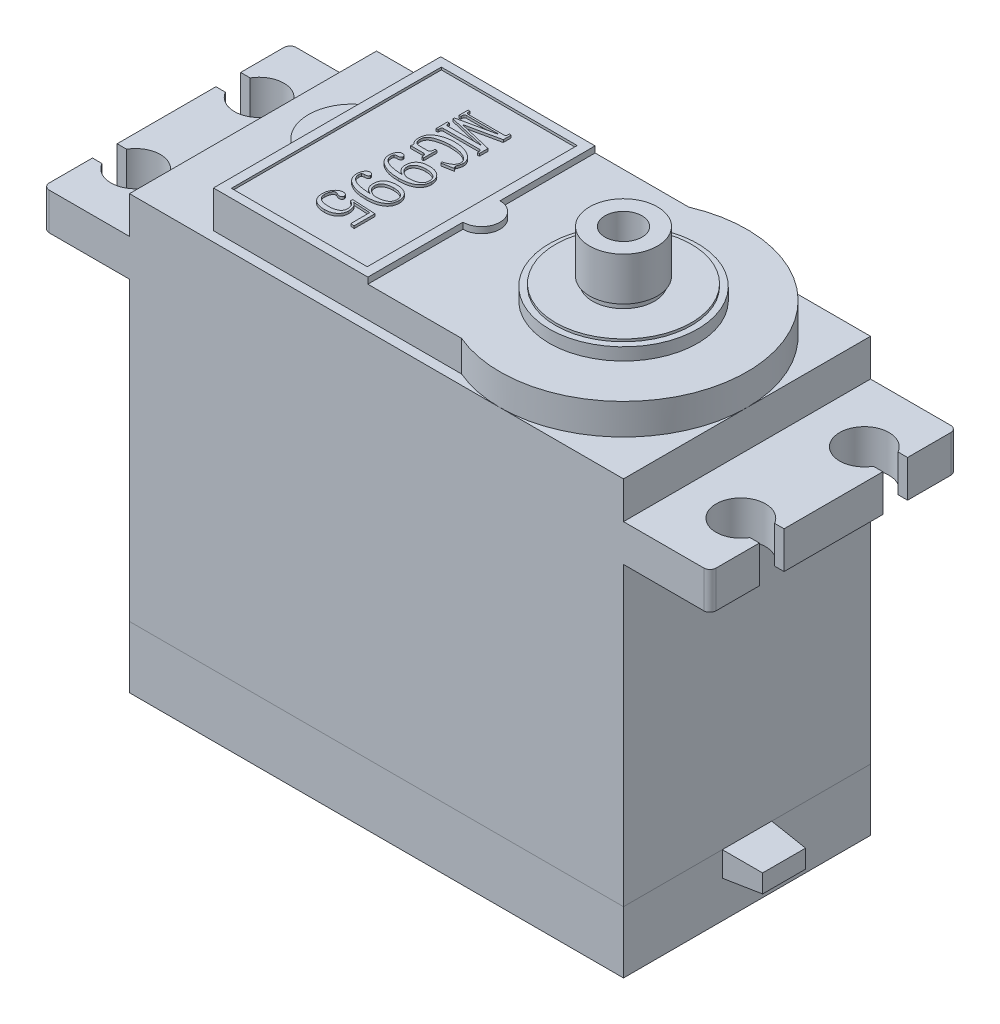
from build123d import *

# Parameters (mm, degrees)
SKETCH_1_W          = 40
SKETCH_1_H          = 37
EXTRUDE_1_DEPTH     = 20
CHAMFER_1_SIZE      = 2
SKETCH_2_W          = 33.2
SKETCH_2_H          = 18.4
EXTRUDE_2_DEPTH     = 3
SKETCH_3_R          = 10
EXTRUDE_3_DEPTH     = 3
CUT_EXTRUDE_1_DEPTH = 3
CUT_EXTRUDE_2_DEPTH = 0.5
SKETCH_6_R          = 1.5
EXTRUDE_4_DEPTH     = 0.5
SKETCH_7_R          = 6
EXTRUDE_5_DEPTH     = 1
SKETCH_8_R          = 5.5
EXTRUDE_6_DEPTH     = 0.2
SKETCH_9_R          = 2.75
EXTRUDE_7_DEPTH     = 4
SKETCH_10_R         = 1.5
CUT_EXTRUDE_3_DEPTH = 3
SKETCH_12_R         = 2.75
SKETCH_12_R_2       = 2.5
CUT_EXTRUDE_4_DEPTH = 0.5
EXTRUDE_START       = -6
SKETCH_13_W         = 7
SKETCH_13_H         = 20
EXTRUDE_8_DEPTH     = 3
SKETCH_14_R         = 2
CUT_EXTRUDE_5_DEPTH = 48.801673611
SKETCH_15_W         = 3.144960108
SKETCH_15_H         = 2
CUT_EXTRUDE_6_DEPTH = 48.801673611
FILLET_1_R          = 0.5
EXTRUDE_START_2     = -0.2
EXTRUDE_9_DEPTH     = 2.8
SKETCH_18_W         = 4
SKETCH_18_H         = 2
EXTRUDE_10_DEPTH    = 3
EXTRUDE_10_TAPER    = 5
SKETCH_19_W         = 11
SKETCH_19_H         = 17
CUT_EXTRUDE_7_DEPTH = 0.2
EXTRUDE_11_DEPTH    = 0.2


with BuildPart() as part:
    # 草图1 → 凸台-拉伸1 (new body)
    with BuildSketch(Plane.XY):
        Rectangle(SKETCH_1_W, SKETCH_1_H)
    extrude(amount=EXTRUDE_1_DEPTH)

    # 倒角1
    chamfer_1_edges = [part.edges().sort_by_distance(p)[0] for p in [
        (0, -18.5, 20),
        (0, -18.5, 0),
        (20, -18.5, 10),
        (-20, -18.5, 10),
    ]]
    chamfer(chamfer_1_edges, length=CHAMFER_1_SIZE)

    # 草图2 → 凸台-拉伸2 (add)
    with BuildSketch(Plane(origin=(0, 18.5, 0), x_dir=(1, 0, 0), z_dir=(0, 1, 0))):
        with Locations((2.6, -10)):
            Rectangle(SKETCH_2_W, SKETCH_2_H)
    extrude(amount=EXTRUDE_2_DEPTH)

    # 草图3 → 凸台-拉伸3 (add)
    with BuildSketch(Plane(origin=(0, 21.5, 0), x_dir=(1, 0, 0), z_dir=(0, 1, 0))):
        with Locations((10, -10)):
            Circle(SKETCH_3_R)
    extrude(amount=-EXTRUDE_3_DEPTH)

    # 草图4 → 切除-拉伸1 (cut)
    with BuildSketch(Plane(origin=(0, 21.5, 0), x_dir=(1, 0, 0), z_dir=(0, 1, 0))):
        with BuildLine():
            Line((13.919183588, -0.8), (19.2, -0.8))
            Line((19.2, -0.8), (19.2, -6.080816412))
            ThreePointArc((19.2, -6.080816412), (17.071067812, -2.928932188), (13.919183588, -0.8))
        make_face()
        with BuildLine():
            Line((13.919183588, -19.2), (19.2, -19.2))
            Line((19.2, -19.2), (19.2, -13.919183588))
            ThreePointArc((19.2, -13.919183588), (17.071067812, -17.071067812), (13.919183588, -19.2))
        make_face()
    extrude(amount=-CUT_EXTRUDE_1_DEPTH, mode=Mode.SUBTRACT)

    # 草图5 → 切除-拉伸2 (cut)
    with BuildSketch(Plane(origin=(0, 21.5, 0), x_dir=(1, 0, 0), z_dir=(0, 1, 0))):
        Polygon((-1.5, -0.8), (-1.5, -20), (20, -20), (20, 0), (-1.5, 0), align=None)
    extrude(amount=-CUT_EXTRUDE_2_DEPTH, mode=Mode.SUBTRACT)

    # 草图6 → 凸台-拉伸4 (add)
    with BuildSketch(Plane(origin=(0, 21, 0), x_dir=(1, 0, 0), z_dir=(0, 1, 0))):
        with Locations((-1.5, -10)):
            Circle(SKETCH_6_R)
    extrude(amount=EXTRUDE_4_DEPTH)

    # 草图7 → 凸台-拉伸5 (add)
    with BuildSketch(Plane(origin=(0, 21, 0), x_dir=(1, 0, 0), z_dir=(0, 1, 0))):
        with Locations(Location((10, -10, 0), (0, 0, 270))):
            Circle(SKETCH_7_R)
    extrude(amount=EXTRUDE_5_DEPTH)

    # 草图8 → 凸台-拉伸6 (add)
    with BuildSketch(Plane(origin=(0, 22, 0), x_dir=(1, 0, 0), z_dir=(0, 1, 0))):
        with Locations(Location((10, -10, 0), (0, 0, 270))):
            Circle(SKETCH_8_R)
    extrude(amount=EXTRUDE_6_DEPTH)

    # 草图9 → 凸台-拉伸7 (add)
    with BuildSketch(Plane(origin=(0, 22.2, 0), x_dir=(1, 0, 0), z_dir=(0, 1, 0))):
        with Locations(Location((10, -10, 0), (0, 0, 270))):
            Circle(SKETCH_9_R)
    extrude(amount=EXTRUDE_7_DEPTH)

    # 草图10 → 切除-拉伸3 (cut)
    with BuildSketch(Plane(origin=(0, 26.2, 0), x_dir=(1, 0, 0), z_dir=(0, 1, 0))):
        with Locations(Location((10, -10, 0), (0, 0, 270))):
            Circle(SKETCH_10_R)
    extrude(amount=-CUT_EXTRUDE_3_DEPTH, mode=Mode.SUBTRACT)

    # 草图12 → 切除-拉伸4 (cut)
    with BuildSketch(Plane(origin=(0, 22.2, 0), x_dir=(1, 0, 0), z_dir=(0, 1, 0))):
        with Locations(Location((10, -10, 0), (0, 0, 270))):
            Circle(SKETCH_12_R)
        with Locations(Location((10, -10, 0), (0, 0, 270))):
            Circle(SKETCH_12_R_2, mode=Mode.SUBTRACT)
    extrude(amount=CUT_EXTRUDE_4_DEPTH, mode=Mode.SUBTRACT)

    # 草图13 → 凸台-拉伸8 (add)
    with BuildSketch(Plane(origin=(0, 18.5, 0), x_dir=(1, 0, 0), z_dir=(0, 1, 0)).offset(EXTRUDE_START)):
        with Locations((23.5, -10)):
            Rectangle(SKETCH_13_W, SKETCH_13_H)
        with Locations((-23.5, -10)):
            Rectangle(SKETCH_13_W, SKETCH_13_H)
    extrude(amount=EXTRUDE_8_DEPTH)

    # 草图14 → 切除-拉伸5 (cut, through all)
    with BuildSketch(Plane(origin=(0, 15.5, 0), x_dir=(1, 0, 0), z_dir=(0, 1, 0))):
        with Locations(Location((24.5, -5, 0), (0, 0, 270))):
            Circle(SKETCH_14_R)
        with Locations(Location((24.5, -15, 0), (0, 0, 270))):
            Circle(SKETCH_14_R)
        with Locations(Location((-24.5, -15, 0), (0, 0, 270))):
            Circle(SKETCH_14_R)
        with Locations(Location((-24.5, -5, 0), (0, 0, 270))):
            Circle(SKETCH_14_R)
    extrude(amount=-CUT_EXTRUDE_5_DEPTH, mode=Mode.SUBTRACT)

    # 草图15 → 切除-拉伸6 (cut, through all)
    with BuildSketch(Plane(origin=(0, 15.5, 0), x_dir=(1, 0, 0), z_dir=(0, 1, 0))):
        with Locations((26.464456373, -5)):
            Rectangle(SKETCH_15_W, SKETCH_15_H)
        with Locations((26.464456373, -15)):
            Rectangle(SKETCH_15_W, SKETCH_15_H)
        with Locations((-26.464456373, -15)):
            Rectangle(SKETCH_15_W, SKETCH_15_H)
        with Locations((-26.464456373, -5)):
            Rectangle(SKETCH_15_W, SKETCH_15_H)
    extrude(amount=-CUT_EXTRUDE_6_DEPTH, mode=Mode.SUBTRACT)

    # 圆角1
    fillet_1_edges = [part.edges().sort_by_distance(p)[0] for p in [
        (-27, 14, 20),
        (-27, 14, 0),
        (27, 14, 0),
        (27, 14, 20),
    ]]
    fillet(fillet_1_edges, radius=FILLET_1_R)

    # 草图16 → 凸台-拉伸9 (add)
    with BuildSketch(Plane(origin=(0, 21.5, 0), x_dir=(1, 0, 0), z_dir=(0, 1, 0)).offset(EXTRUDE_START_2)):
        with BuildLine():
            Line((-14, -7.127718677), (-14, -12.872281323))
            ThreePointArc((-14, -12.872281323), (-15.5, -10), (-14, -7.127718677))
        make_face()
    extrude(amount=-EXTRUDE_9_DEPTH)

    # 草图18 → 凸台-拉伸10 (add)
    with BuildSketch(Plane(origin=(20, 0, 0), x_dir=(0, 0, -1), z_dir=(1, 0, 0))):
        with Locations((-10, -12.5)):
            Rectangle(SKETCH_18_W, SKETCH_18_H)
    extrude(amount=EXTRUDE_10_DEPTH, taper=EXTRUDE_10_TAPER)

    # 草图19 → 切除-拉伸7 (cut)
    with BuildSketch(Plane(origin=(0, 21.5, 0), x_dir=(1, 0, 0), z_dir=(0, 1, 0))):
        with Locations((-7.75, -10)):
            Rectangle(SKETCH_19_W, SKETCH_19_H)
    extrude(amount=-CUT_EXTRUDE_7_DEPTH, mode=Mode.SUBTRACT)

    # 草图20 → 凸台-拉伸11 (add)
    # profile 1 of 5: a face of its own
    with BuildSketch(Plane(origin=(0, 21.3, 0), x_dir=(1, 0, 0), z_dir=(0, 1, 0))):
        with BuildLine():
            add(Edge.make_bspline(
                [(-8.84516059, -5.722222222), (-8.85787049, -5.723014085), (-8.881942841, -5.724513861), (-8.916370905, -5.734174173), (-8.944677077, -5.75314092), (-8.968232942, -5.778033073), (-8.985097452, -5.808956215), (-8.998422683, -5.843598085), (-9.005900694, -5.882678632), (-9.006587817, -5.910053955), (-9.006944444, -5.924262153)],
                knots=[0, 0, 0, 0, 1.042968028, 1.975365066, 2.8907423, 3.801164498, 4.758861516, 5.757301539, 6.836006302, 8, 8, 8, 8], degree=3))
            Line((-9.006944444, -5.924262153), (-9.006944444, -6.013888889))
            Line((-9.006944444, -6.013888889), (-9.152777778, -6.013888889))
            Line((-9.152777778, -6.013888889), (-9.152777778, -5.090277778))
            Line((-9.152777778, -5.090277778), (-9.006944444, -5.090277778))
            Line((-9.006944444, -5.090277778), (-9.006944444, -5.194335937))
            add(Edge.make_bspline(
                [(-9.006944444, -5.194335937), (-9.006637075, -5.210317157), (-9.006066861, -5.239964627), (-8.998757766, -5.280885945), (-8.985979339, -5.314282965), (-8.968179161, -5.340911334), (-8.944009951, -5.35982386), (-8.915198712, -5.372368656), (-8.881894153, -5.381341437), (-8.857888341, -5.381735509), (-8.84516059, -5.381944444)],
                knots=[0, 0, 0, 0, 1.338096298, 2.482361895, 3.463338907, 4.316722401, 5.1317985, 5.995666214, 6.93731314, 8, 8, 8, 8], degree=3))
            Line((-8.84516059, -5.381944444), (-6.201931424, -5.381944444))
            Line((-6.201931424, -5.381944444), (-6.201931424, -5.341688368))
            Line((-6.201931424, -5.341688368), (-9.152777778, -4.658854167))
            Line((-9.152777778, -4.658854167), (-9.152777778, -4.538085937))
            Line((-9.152777778, -4.538085937), (-6.262695312, -3.915256076))
            Line((-6.262695312, -3.915256076), (-6.262695312, -3.875))
            Line((-6.262695312, -3.875), (-8.84516059, -3.875))
            add(Edge.make_bspline(
                [(-8.84516059, -3.875), (-8.857924896, -3.875624789), (-8.882257538, -3.876815828), (-8.916252282, -3.888809894), (-8.945280606, -3.908186367), (-8.968193294, -3.93563155), (-8.985301781, -3.968798557), (-8.99837163, -4.006346187), (-9.005946719, -4.048634944), (-9.006602209, -4.078274809), (-9.006944444, -4.09375)],
                knots=[0, 0, 0, 0, 0.994673065, 1.896148803, 2.780067344, 3.692559487, 4.657844563, 5.684502589, 6.79106185, 8, 8, 8, 8], degree=3))
            Line((-9.006944444, -4.09375), (-9.006944444, -4.166666667))
            Line((-9.006944444, -4.166666667), (-9.152777778, -4.166666667))
            Line((-9.152777778, -4.166666667), (-9.152777778, -3.4375))
            Line((-9.152777778, -3.4375), (-9.006944444, -3.4375))
            Line((-9.006944444, -3.4375), (-9.006944444, -3.510416667))
            add(Edge.make_bspline(
                [(-9.006944444, -3.510416667), (-9.006640117, -3.529178465), (-9.00607773, -3.563849692), (-8.998835008, -3.611526584), (-8.986235461, -3.650239606), (-8.968520651, -3.680905642), (-8.944456797, -3.703111), (-8.915636225, -3.718359189), (-8.881936494, -3.727740957), (-8.857885741, -3.728673345), (-8.84516059, -3.729166667)],
                knots=[0, 0, 0, 0, 1.438107258, 2.657578084, 3.683058142, 4.54557284, 5.342418122, 6.159126252, 7.026001517, 8, 8, 8, 8], degree=3))
            Line((-8.84516059, -3.729166667), (-5.960394965, -3.729166667))
            add(Edge.make_bspline(
                [(-5.960394965, -3.729166667), (-5.947690967, -3.728574266), (-5.923500083, -3.72744622), (-5.889808787, -3.719343763), (-5.861088512, -3.705265799), (-5.837320574, -3.684950059), (-5.819416572, -3.656673206), (-5.806647474, -3.620723507), (-5.799548207, -3.576519616), (-5.798938231, -3.544368731), (-5.798611111, -3.527126736)],
                knots=[0, 0, 0, 0, 1.02027045, 1.942793308, 2.76147956, 3.568971315, 4.420844179, 5.418354805, 6.615505802, 8, 8, 8, 8], degree=3))
            Line((-5.798611111, -3.527126736), (-5.798611111, -3.4375))
            Line((-5.798611111, -3.4375), (-5.652777778, -3.4375))
            Line((-5.652777778, -3.4375), (-5.652777778, -4.082356771))
            Line((-5.652777778, -4.082356771), (-8.29828559, -4.652777778))
            Line((-8.29828559, -4.652777778), (-8.29828559, -4.694552951))
            Line((-8.29828559, -4.694552951), (-5.652777778, -5.317382812))
            Line((-5.652777778, -5.317382812), (-5.652777778, -6.013888889))
            Line((-5.652777778, -6.013888889), (-5.798611111, -6.013888889))
            Line((-5.798611111, -6.013888889), (-5.798611111, -5.924262153))
            add(Edge.make_bspline(
                [(-5.798611111, -5.924262153), (-5.798967916, -5.910054248), (-5.799655382, -5.882679489), (-5.807131026, -5.843595044), (-5.820464362, -5.808966522), (-5.837300712, -5.777997006), (-5.860808651, -5.753422705), (-5.888726298, -5.733779174), (-5.923425524, -5.724669527), (-5.947703999, -5.723062339), (-5.960394965, -5.722222222)],
                knots=[0, 0, 0, 0, 1.163623614, 2.241985409, 3.240107984, 4.197500508, 5.107633243, 6.005382642, 6.957363577, 8, 8, 8, 8], degree=3))
            Line((-5.960394965, -5.722222222), (-8.84516059, -5.722222222))
        make_face()
    # profile 2 of 5: a face of its own
    with BuildSketch(Plane(origin=(0, 21.3, 0), x_dir=(1, 0, 0), z_dir=(0, 1, 0))):
        with BuildLine():
            add(Edge.make_bspline(
                [(-5.75, -7.393988715), (-5.751398335, -7.369304792), (-5.754224314, -7.319419556), (-5.774920857, -7.245904698), (-5.808291765, -7.174330684), (-5.854683907, -7.104531497), (-5.914776557, -7.036715261), (-5.988264432, -6.971097684), (-6.074034131, -6.906214949), (-6.172638914, -6.843188666), (-6.284916036, -6.784786929), (-6.4112088, -6.733682154), (-6.551499776, -6.691838778), (-6.705547356, -6.65698118), (-6.873275871, -6.630184943), (-7.05475712, -6.610418162), (-7.249967431, -6.599290747), (-7.384787791, -6.597926765), (-7.454427083, -6.597222222)],
                knots=[0, 0, 0, 0, 0.579148521, 1.170436294, 1.779566491, 2.42757893, 3.131134494, 3.901359329, 4.737249456, 5.654197943, 6.646027063, 7.704750082, 8.84818316, 10.079831431, 11.41100908, 12.83435328, 14.364836022, 16, 16, 16, 16], degree=3))
            add(Edge.make_bspline(
                [(-7.454427083, -6.597222222), (-7.502042159, -6.597776728), (-7.596600337, -6.598877915), (-7.737450981, -6.608614044), (-7.876379358, -6.622608779), (-8.013478558, -6.643295093), (-8.148586013, -6.66977991), (-8.281910143, -6.702496431), (-8.413016931, -6.741534615), (-8.540752282, -6.784117226), (-8.659935904, -6.83373465), (-8.765801327, -6.891637833), (-8.855053021, -6.959029258), (-8.9285496, -7.034031873), (-8.985778834, -7.117234449), (-9.026907922, -7.20840695), (-9.05065738, -7.307976182), (-9.053896003, -7.376899717), (-9.055555556, -7.412217882)],
                knots=[0, 0, 0, 0, 1.154899231, 2.29349984, 3.423470847, 4.541342973, 5.655497185, 6.762263308, 7.869983304, 8.973165053, 10.027194472, 10.997756558, 11.892000269, 12.730267974, 13.534337074, 14.328802258, 15.143635939, 16, 16, 16, 16], degree=3))
            add(Edge.make_bspline(
                [(-9.055555556, -7.412217882), (-9.05435693, -7.446964345), (-9.052075543, -7.513098511), (-9.035909924, -7.60704007), (-9.006714888, -7.689625648), (-8.966841714, -7.761724975), (-8.913405819, -7.820532677), (-8.848441382, -7.865944746), (-8.771479426, -7.896829446), (-8.715550016, -7.905306371), (-8.686414931, -7.909722222)],
                knots=[0, 0, 0, 0, 1.20833764, 2.299871537, 3.299654063, 4.242157538, 5.145988138, 6.037555229, 6.977711449, 8, 8, 8, 8], degree=3))
            Line((-8.686414931, -7.909722222), (-7.989149306, -7.909722222))
            add(Edge.make_bspline(
                [(-7.989149306, -7.909722222), (-7.969846783, -7.909129672), (-7.933333213, -7.908008775), (-7.882219416, -7.896108628), (-7.839203564, -7.874910361), (-7.802887062, -7.846638281), (-7.775973951, -7.808312746), (-7.75606187, -7.762968808), (-7.744911441, -7.709215205), (-7.743699753, -7.671021788), (-7.743055556, -7.650716146)],
                knots=[0, 0, 0, 0, 1.13039531, 2.138309509, 3.047648992, 3.923802705, 4.805470025, 5.762375251, 6.810360214, 8, 8, 8, 8], degree=3))
            Line((-7.743055556, -7.650716146), (-7.743055556, -7.520833333))
            Line((-7.743055556, -7.520833333), (-7.597222222, -7.520833333))
            Line((-7.597222222, -7.520833333), (-7.597222222, -8.590277778))
            Line((-7.597222222, -8.590277778), (-7.743055556, -8.590277778))
            Line((-7.743055556, -8.590277778), (-7.743055556, -8.483940972))
            add(Edge.make_bspline(
                [(-7.743055556, -8.483940972), (-7.743698628, -8.466904672), (-7.744924383, -8.434431929), (-7.756633292, -8.388153293), (-7.776348576, -8.347343347), (-7.804374671, -8.312917836), (-7.837565969, -8.284440817), (-7.877083089, -8.264210551), (-7.921559863, -8.251799938), (-7.953113267, -8.250612798), (-7.969401042, -8.25)],
                knots=[0, 0, 0, 0, 1.112973778, 2.121429564, 3.099354558, 4.053992283, 5.006327592, 5.939892249, 6.936578437, 8, 8, 8, 8], degree=3))
            Line((-7.969401042, -8.25), (-8.999348958, -8.25))
            add(Edge.make_bspline(
                [(-8.999348958, -8.25), (-8.993020332, -8.237193905), (-8.981540285, -8.213963816), (-8.968562417, -8.17891541), (-8.958897893, -8.144205183), (-8.958527643, -8.119939639), (-8.958333333, -8.107204861)],
                knots=[0, 0, 0, 0, 1.140474452, 2.068805774, 2.986491759, 4, 4, 4, 4], degree=3))
            add(Edge.make_bspline(
                [(-8.958333333, -8.107204861), (-8.958679274, -8.093487955), (-8.95937145, -8.066042423), (-8.968100971, -8.02454474), (-8.985348389, -7.981106414), (-9.007256699, -7.956954829), (-9.019097222, -7.94390191)],
                knots=[0, 0, 0, 0, 0.916914834, 1.834613022, 2.829699161, 4, 4, 4, 4], degree=3))
            add(Edge.make_bspline(
                [(-9.019097222, -7.94390191), (-9.035323927, -7.92376481), (-9.067183203, -7.884227923), (-9.104989536, -7.819853471), (-9.138067773, -7.755678064), (-9.162350212, -7.68898995), (-9.179543366, -7.619595159), (-9.192627215, -7.547323047), (-9.200302451, -7.471123597), (-9.201021445, -7.419071201), (-9.201388889, -7.392469618)],
                knots=[0, 0, 0, 0, 1.04375356, 2.049290532, 3.010263608, 3.958789813, 4.909300846, 5.8968189, 6.925160997, 8, 8, 8, 8], degree=3))
            add(Edge.make_bspline(
                [(-9.201388889, -7.392469618), (-9.199967648, -7.342973949), (-9.197206262, -7.246806818), (-9.170503946, -7.107838381), (-9.128014761, -6.978914853), (-9.068468225, -6.859727602), (-8.990668553, -6.751682566), (-8.895841531, -6.654148399), (-8.783800355, -6.567374948), (-8.656492995, -6.491861299), (-8.519222115, -6.426864021), (-8.37781341, -6.367644479), (-8.232574233, -6.318479833), (-8.083963991, -6.27801886), (-7.931739282, -6.246805062), (-7.775690624, -6.225197426), (-7.61622493, -6.210854643), (-7.508639439, -6.209178129), (-7.454427083, -6.208333333)],
                knots=[0, 0, 0, 0, 1.006449748, 1.955471811, 2.868019607, 3.76218068, 4.655940748, 5.567003281, 6.521535539, 7.531659171, 8.57339904, 9.610758102, 10.650431203, 11.691737646, 12.743788318, 13.810689198, 14.896805729, 16, 16, 16, 16], degree=3))
            add(Edge.make_bspline(
                [(-7.454427083, -6.208333333), (-7.392114615, -6.209390795), (-7.2695804, -6.211470238), (-7.089183113, -6.226782654), (-6.915392912, -6.252565819), (-6.748270151, -6.288646646), (-6.588090454, -6.336316941), (-6.434353987, -6.392650725), (-6.28802666, -6.461113568), (-6.149268011, -6.537211692), (-6.022575639, -6.622228221), (-5.910663414, -6.713096391), (-5.816657136, -6.810219655), (-5.738045369, -6.911817398), (-5.678735278, -7.020572708), (-5.635659706, -7.134219741), (-5.608607162, -7.25322081), (-5.605658123, -7.334601711), (-5.604166667, -7.375759549)],
                knots=[0, 0, 0, 0, 1.241106912, 2.440571924, 3.603115146, 4.738699616, 5.842944677, 6.92960297, 7.996849183, 9.057821466, 10.078885984, 11.031966828, 11.923585032, 12.765799292, 13.582845168, 14.380868328, 15.181135165, 16, 16, 16, 16], degree=3))
            add(Edge.make_bspline(
                [(-5.604166667, -7.375759549), (-5.604971372, -7.396816092), (-5.606649541, -7.440728338), (-5.618759135, -7.508957112), (-5.639006393, -7.581830192), (-5.664846649, -7.656079626), (-5.690619854, -7.725197341), (-5.710803587, -7.78284757), (-5.723328526, -7.825692003), (-5.726140829, -7.849681872), (-5.727213542, -7.858832465)],
                knots=[0, 0, 0, 0, 1.008740108, 2.103671241, 3.310252722, 4.629968424, 5.869580075, 6.844035058, 7.559073694, 8, 8, 8, 8], degree=3))
            add(Edge.make_bspline(
                [(-5.727213542, -7.858832465), (-5.725609859, -7.879017022), (-5.722285492, -7.920858753), (-5.698823493, -7.981443209), (-5.659851096, -8.037764311), (-5.623048011, -8.065587028), (-5.604166667, -8.079861111)],
                knots=[0, 0, 0, 0, 0.919891208, 1.906895455, 2.926159958, 4, 4, 4, 4], degree=3))
            Line((-5.604166667, -8.079861111), (-6.535373264, -8.25))
            Line((-6.535373264, -8.25), (-6.576388889, -8.130750868))
            add(Edge.make_bspline(
                [(-6.576388889, -8.130750868), (-6.541366145, -8.120638398), (-6.47349366, -8.101040889), (-6.376264531, -8.06818545), (-6.285891546, -8.034430052), (-6.203867323, -7.997079989), (-6.128423697, -7.959261406), (-6.0609582, -7.91873988), (-5.999712017, -7.877689538), (-5.946906599, -7.832744885), (-5.900094301, -7.786718874), (-5.860554265, -7.737358015), (-5.825796526, -7.686786738), (-5.798510055, -7.632662399), (-5.776049122, -7.576682886), (-5.761159199, -7.517651409), (-5.751666009, -7.456581939), (-5.750560284, -7.415039007), (-5.75, -7.393988715)],
                knots=[0, 0, 0, 0, 1.460806755, 2.830977103, 4.112458269, 5.325120951, 6.441495576, 7.492598779, 8.477712069, 9.392366797, 10.267734122, 11.10449228, 11.923464887, 12.722197106, 13.528690728, 14.335950009, 15.156806325, 16, 16, 16, 16], degree=3))
        make_face()
    # profile 3 of 5: a face of its own
    with BuildSketch(Plane(origin=(0, 21.3, 0), x_dir=(1, 0, 0), z_dir=(0, 1, 0))):
        with BuildLine():
            add(Edge.make_bspline(
                [(-7.840277778, -9.821506076), (-7.839666296, -9.788548321), (-7.838471816, -9.724167971), (-7.825689119, -9.630165468), (-7.80643112, -9.540981653), (-7.778264071, -9.456857494), (-7.741336037, -9.378164691), (-7.697298401, -9.304189785), (-7.645273463, -9.235246593), (-7.584895444, -9.17176106), (-7.515443999, -9.114242449), (-7.435596543, -9.064826433), (-7.345860774, -9.022864769), (-7.246142953, -8.989181915), (-7.136849347, -8.962624576), (-7.017710476, -8.943967812), (-6.888786754, -8.932565442), (-6.799467666, -8.931239809), (-6.753363715, -8.930555556)],
                knots=[0, 0, 0, 0, 0.986331013, 1.926719061, 2.835399471, 3.715284699, 4.576817716, 5.433667726, 6.288872625, 7.157614415, 8.051659588, 8.981474926, 9.961638478, 11.011786625, 12.1279503, 13.325764178, 14.619636185, 16, 16, 16, 16], degree=3))
            add(Edge.make_bspline(
                [(-6.753363715, -8.930555556), (-6.713066498, -8.931109677), (-6.634025118, -8.932196565), (-6.518320811, -8.945896106), (-6.40751208, -8.966039565), (-6.301947743, -8.99472885), (-6.20155732, -9.032226218), (-6.106525049, -9.078206627), (-6.015486857, -9.13087643), (-5.931770318, -9.193416799), (-5.854396592, -9.262080529), (-5.787210544, -9.339128781), (-5.730969571, -9.423398907), (-5.683527563, -9.513956105), (-5.648579371, -9.612335866), (-5.622408647, -9.717073486), (-5.60721184, -9.828911542), (-5.605201142, -9.905769943), (-5.604166667, -9.9453125)],
                knots=[0, 0, 0, 0, 1.118553031, 2.193996999, 3.231082086, 4.244318513, 5.227766633, 6.202706886, 7.173479839, 8.143845268, 9.099760343, 10.041685852, 10.973876731, 11.907895618, 12.873280525, 13.865811324, 14.901990223, 16, 16, 16, 16], degree=3))
            add(Edge.make_bspline(
                [(-5.604166667, -9.9453125), (-5.605145835, -9.986417707), (-5.607067843, -10.067102992), (-5.627687354, -10.184279003), (-5.659155714, -10.294693802), (-5.704583482, -10.397977816), (-5.763647787, -10.49381992), (-5.834591539, -10.583541136), (-5.919272591, -10.665180385), (-6.016177175, -10.739616637), (-6.125011554, -10.806528112), (-6.245783478, -10.864171491), (-6.37801421, -10.912877312), (-6.521779022, -10.951720886), (-6.676811843, -10.982814306), (-6.843422926, -11.00566085), (-7.021798468, -11.01810814), (-7.144512884, -11.019908274), (-7.207573785, -11.020833333)],
                knots=[0, 0, 0, 0, 0.906657899, 1.779675981, 2.618152282, 3.436582275, 4.262007199, 5.097459533, 5.955258992, 6.851953981, 7.790531567, 8.770588859, 9.801683667, 10.897421031, 12.055071778, 13.290679769, 14.607725314, 16, 16, 16, 16], degree=3))
            add(Edge.make_bspline(
                [(-7.207573785, -11.020833333), (-7.277981747, -11.019757074), (-7.415927228, -11.017648434), (-7.618147641, -11.002778724), (-7.811055776, -10.975839559), (-7.994770246, -10.939739343), (-8.16932138, -10.893731131), (-8.33428249, -10.836411908), (-8.490181341, -10.769104371), (-8.635470942, -10.691425715), (-8.767529794, -10.6049426), (-8.88324782, -10.509717051), (-8.981787462, -10.406570906), (-9.062378744, -10.295044763), (-9.124792162, -10.174988531), (-9.168801294, -10.047016653), (-9.196275065, -9.911283213), (-9.19966292, -9.818092866), (-9.201388889, -9.770616319)],
                knots=[0, 0, 0, 0, 1.291628802, 2.530599555, 3.716893453, 4.862801601, 5.963520883, 7.025527529, 8.063547353, 9.075542967, 10.044277791, 10.954752488, 11.818824259, 12.654104127, 13.470523775, 14.291633409, 15.129659367, 16, 16, 16, 16], degree=3))
            add(Edge.make_bspline(
                [(-9.201388889, -9.770616319), (-9.200043401, -9.728220737), (-9.197428206, -9.645817371), (-9.173901372, -9.527001089), (-9.136728315, -9.416824979), (-9.093057738, -9.332886023), (-9.051494839, -9.272378704), (-9.017636493, -9.233119215), (-8.9811571, -9.199404941), (-8.942071639, -9.172229438), (-8.899996928, -9.151332928), (-8.855887392, -9.136087415), (-8.809096954, -9.12667382), (-8.777097957, -9.125563671), (-8.760850694, -9.125)],
                knots=[0, 0, 0, 0, 1.759706461, 3.420302972, 5.01027557, 6.576940977, 7.332651618, 8.055972819, 8.726015641, 9.391252851, 10.026284402, 10.671598785, 11.325513766, 12, 12, 12, 12], degree=3))
            add(Edge.make_bspline(
                [(-8.760850694, -9.125), (-8.733968897, -9.127382299), (-8.678033747, -9.132339344), (-8.612182871, -9.161859457), (-8.565219316, -9.196904566), (-8.537919217, -9.233096754), (-8.523810296, -9.278739911), (-8.521867384, -9.311254311), (-8.520833333, -9.328559028)],
                knots=[0, 0, 0, 0, 1.369310628, 2.849236374, 3.603338611, 4.341807775, 5.117481926, 6, 6, 6, 6], degree=3))
            add(Edge.make_bspline(
                [(-8.520833333, -9.328559028), (-8.521633233, -9.345672574), (-8.523136521, -9.377834838), (-8.540162854, -9.421920155), (-8.570361265, -9.455792812), (-8.610802782, -9.478646846), (-8.657500754, -9.493302501), (-8.707364942, -9.505989037), (-8.761432803, -9.512644136), (-8.798559415, -9.513463755), (-8.81781684, -9.513888889)],
                knots=[0, 0, 0, 0, 1.032063663, 1.939603978, 2.797144082, 3.724638344, 4.713021373, 5.753465807, 6.834731722, 8, 8, 8, 8], degree=3))
            add(Edge.make_bspline(
                [(-8.81781684, -9.513888889), (-8.841768979, -9.5145905), (-8.885756888, -9.515879002), (-8.943218568, -9.532290987), (-8.986149975, -9.552072509), (-9.007161637, -9.569002759), (-9.016059028, -9.576171875)],
                knots=[0, 0, 0, 0, 1.349572764, 2.478479391, 3.355711911, 4, 4, 4, 4], degree=3))
            add(Edge.make_bspline(
                [(-9.016059028, -9.576171875), (-9.022473094, -9.585268366), (-9.037745239, -9.606927474), (-9.046578037, -9.651360534), (-9.054770732, -9.703936114), (-9.055285574, -9.742197248), (-9.055555556, -9.762261285)],
                knots=[0, 0, 0, 0, 0.684757907, 1.630435801, 2.757406835, 4, 4, 4, 4], degree=3))
            add(Edge.make_bspline(
                [(-9.055555556, -9.762261285), (-9.054564233, -9.792762212), (-9.052609109, -9.852917247), (-9.031790854, -9.940163079), (-8.999592824, -10.022904646), (-8.954190666, -10.100978953), (-8.895660114, -10.174396574), (-8.824210243, -10.243027304), (-8.739872686, -10.306806976), (-8.64245616, -10.366562573), (-8.529610289, -10.420801363), (-8.399827972, -10.467786431), (-8.253265095, -10.510487678), (-8.089245404, -10.546264557), (-7.907923625, -10.576230758), (-7.709551096, -10.601213783), (-7.493655737, -10.619933645), (-7.343814932, -10.627841087), (-7.266059028, -10.631944444)],
                knots=[0, 0, 0, 0, 0.669975414, 1.321349811, 1.961696807, 2.618125568, 3.300219908, 4.021176472, 4.792199011, 5.622466949, 6.531884362, 7.541853039, 8.65600558, 9.888643045, 11.233079424, 12.698624174, 14.286838752, 16, 16, 16, 16], degree=3))
            add(Edge.make_bspline(
                [(-7.266059028, -10.631944444), (-7.305838522, -10.613971387), (-7.384705922, -10.578337745), (-7.492839238, -10.507370892), (-7.591180688, -10.424632893), (-7.663906698, -10.345580168), (-7.715961555, -10.276703099), (-7.748198137, -10.220256543), (-7.777810392, -10.162223184), (-7.800153613, -10.099770202), (-7.818858537, -10.034947323), (-7.83018442, -9.966342437), (-7.83952459, -9.895182193), (-7.840023775, -9.846352364), (-7.840277778, -9.821506076)],
                knots=[0, 0, 0, 0, 1.482402436, 2.939032521, 4.380831523, 5.843098527, 6.581770596, 7.311153363, 8.050377073, 8.793999179, 9.562664727, 10.341150661, 11.155920714, 12, 12, 12, 12], degree=3))
        make_face()
        with BuildLine():
            add(Edge.make_bspline(
                [(-6.728298611, -9.270833333), (-6.764513759, -9.271532598), (-6.834998297, -9.272893556), (-6.937538504, -9.280067309), (-7.033201721, -9.293677669), (-7.122273482, -9.312808357), (-7.204699505, -9.336693059), (-7.280785493, -9.366126551), (-7.349231412, -9.40242192), (-7.411900521, -9.442045673), (-7.466256419, -9.487413436), (-7.514789303, -9.534277154), (-7.555445679, -9.584749621), (-7.588316563, -9.63848771), (-7.614364482, -9.694747056), (-7.63280322, -9.753963986), (-7.643546683, -9.81605059), (-7.645062223, -9.858429069), (-7.645833333, -9.879991319)],
                knots=[0, 0, 0, 0, 1.411801645, 2.747750403, 4.003853587, 5.174928178, 6.296034531, 7.34613145, 8.348150733, 9.311719258, 10.230373517, 11.102695307, 11.938059598, 12.748810654, 13.552503436, 14.348463832, 15.159695262, 16, 16, 16, 16], degree=3))
            add(Edge.make_bspline(
                [(-7.645833333, -9.879991319), (-7.644900317, -9.905104596), (-7.643059426, -9.954654437), (-7.630078816, -10.027865552), (-7.606715403, -10.09801588), (-7.575531272, -10.165863829), (-7.535607432, -10.231416312), (-7.485572588, -10.293357333), (-7.427835693, -10.353887089), (-7.361475139, -10.409339304), (-7.292077786, -10.460848574), (-7.222491374, -10.50655914), (-7.153872245, -10.544761361), (-7.086725226, -10.575876505), (-7.021350454, -10.601688102), (-6.956653912, -10.619198575), (-6.892931867, -10.629312314), (-6.850872472, -10.631073638), (-6.830078125, -10.631944444)],
                knots=[0, 0, 0, 0, 0.996807918, 1.966755489, 2.939303043, 3.924132418, 4.925590783, 5.977231448, 7.078969054, 8.241031871, 9.404875228, 10.508765249, 11.543509628, 12.519219778, 13.444996095, 14.329995628, 15.174342639, 16, 16, 16, 16], degree=3))
            add(Edge.make_bspline(
                [(-6.830078125, -10.631944444), (-6.790315625, -10.631586832), (-6.712738751, -10.630889129), (-6.599413299, -10.623150466), (-6.492127936, -10.610474045), (-6.39096787, -10.592216958), (-6.295672621, -10.569260088), (-6.205832439, -10.542782227), (-6.12294343, -10.508673483), (-6.045771435, -10.471392885), (-5.976346019, -10.427494003), (-5.915679367, -10.377058843), (-5.863991204, -10.320250251), (-5.821783798, -10.256807255), (-5.79003582, -10.186551495), (-5.765980512, -10.110714107), (-5.752498142, -10.028075705), (-5.750848953, -9.970931073), (-5.75, -9.941514757)],
                knots=[0, 0, 0, 0, 1.318492647, 2.572387029, 3.764868768, 4.899640807, 5.979008766, 7.014880814, 8.00185471, 8.948130537, 9.854214689, 10.718565921, 11.556746202, 12.392778865, 13.234316917, 14.105371323, 15.024702852, 16, 16, 16, 16], degree=3))
            add(Edge.make_bspline(
                [(-5.75, -9.941514757), (-5.750861862, -9.913608313), (-5.752532726, -9.859506983), (-5.765825486, -9.781246549), (-5.786803474, -9.708274257), (-5.817426354, -9.64108688), (-5.856458579, -9.579648071), (-5.904358936, -9.524208822), (-5.960898103, -9.474716724), (-6.025937282, -9.431645302), (-6.097391195, -9.394376306), (-6.173168563, -9.360328742), (-6.254469569, -9.333838356), (-6.339532546, -9.309349801), (-6.430181823, -9.292747887), (-6.525177564, -9.279572523), (-6.625126983, -9.271912033), (-6.69334665, -9.27119877), (-6.728298611, -9.270833333)],
                knots=[0, 0, 0, 0, 1.001118089, 1.940835575, 2.840871599, 3.719315313, 4.58148531, 5.444947451, 6.340014928, 7.270059601, 8.237618571, 9.23045323, 10.247773547, 11.303848686, 12.405282545, 13.551685249, 14.745619747, 16, 16, 16, 16], degree=3))
        make_face(mode=Mode.SUBTRACT)
    # profile 4 of 5: a face of its own
    with BuildSketch(Plane(origin=(0, 21.3, 0), x_dir=(1, 0, 0), z_dir=(0, 1, 0))):
        with BuildLine():
            add(Edge.make_bspline(
                [(-7.840277778, -12.446506076), (-7.839666296, -12.413548321), (-7.838471816, -12.349167971), (-7.825689119, -12.255165468), (-7.80643112, -12.165981653), (-7.778264071, -12.081857494), (-7.741336037, -12.003164691), (-7.697298401, -11.929189785), (-7.645273463, -11.860246593), (-7.584895444, -11.79676106), (-7.515443999, -11.739242449), (-7.435596543, -11.689826433), (-7.345860774, -11.647864769), (-7.246142953, -11.614181915), (-7.136849347, -11.587624576), (-7.017710476, -11.568967812), (-6.888786754, -11.557565442), (-6.799467666, -11.556239809), (-6.753363715, -11.555555556)],
                knots=[0, 0, 0, 0, 0.986331013, 1.926719061, 2.835399471, 3.715284699, 4.576817716, 5.433667726, 6.288872625, 7.157614415, 8.051659588, 8.981474926, 9.961638478, 11.011786625, 12.1279503, 13.325764178, 14.619636185, 16, 16, 16, 16], degree=3))
            add(Edge.make_bspline(
                [(-6.753363715, -11.555555556), (-6.713066498, -11.556109677), (-6.634025118, -11.557196565), (-6.518320811, -11.570896106), (-6.40751208, -11.591039565), (-6.301947743, -11.61972885), (-6.20155732, -11.657226218), (-6.106525049, -11.703206627), (-6.015486857, -11.75587643), (-5.931770318, -11.818416799), (-5.854396592, -11.887080529), (-5.787210544, -11.964128781), (-5.730969571, -12.048398907), (-5.683527563, -12.138956105), (-5.648579371, -12.237335866), (-5.622408647, -12.342073486), (-5.60721184, -12.453911542), (-5.605201142, -12.530769943), (-5.604166667, -12.5703125)],
                knots=[0, 0, 0, 0, 1.118553031, 2.193996999, 3.231082086, 4.244318513, 5.227766633, 6.202706886, 7.173479839, 8.143845268, 9.099760343, 10.041685852, 10.973876731, 11.907895618, 12.873280525, 13.865811324, 14.901990223, 16, 16, 16, 16], degree=3))
            add(Edge.make_bspline(
                [(-5.604166667, -12.5703125), (-5.605145835, -12.611417707), (-5.607067843, -12.692102992), (-5.627687354, -12.809279003), (-5.659155714, -12.919693802), (-5.704583482, -13.022977816), (-5.763647787, -13.11881992), (-5.834591539, -13.208541136), (-5.919272591, -13.290180385), (-6.016177175, -13.364616637), (-6.125011554, -13.431528112), (-6.245783478, -13.489171491), (-6.37801421, -13.537877312), (-6.521779022, -13.576720886), (-6.676811843, -13.607814306), (-6.843422926, -13.63066085), (-7.021798468, -13.64310814), (-7.144512884, -13.644908274), (-7.207573785, -13.645833333)],
                knots=[0, 0, 0, 0, 0.906657899, 1.779675981, 2.618152282, 3.436582275, 4.262007199, 5.097459533, 5.955258992, 6.851953981, 7.790531567, 8.770588859, 9.801683667, 10.897421031, 12.055071778, 13.290679769, 14.607725314, 16, 16, 16, 16], degree=3))
            add(Edge.make_bspline(
                [(-7.207573785, -13.645833333), (-7.277981747, -13.644757074), (-7.415927228, -13.642648434), (-7.618147641, -13.627778724), (-7.811055776, -13.600839559), (-7.994770246, -13.564739343), (-8.16932138, -13.518731131), (-8.33428249, -13.461411908), (-8.490181341, -13.394104371), (-8.635470942, -13.316425715), (-8.767529794, -13.2299426), (-8.88324782, -13.134717051), (-8.981787462, -13.031570906), (-9.062378744, -12.920044763), (-9.124792162, -12.799988531), (-9.168801294, -12.672016653), (-9.196275065, -12.536283213), (-9.19966292, -12.443092866), (-9.201388889, -12.395616319)],
                knots=[0, 0, 0, 0, 1.291628802, 2.530599555, 3.716893453, 4.862801601, 5.963520883, 7.025527529, 8.063547353, 9.075542967, 10.044277791, 10.954752488, 11.818824259, 12.654104127, 13.470523775, 14.291633409, 15.129659367, 16, 16, 16, 16], degree=3))
            add(Edge.make_bspline(
                [(-9.201388889, -12.395616319), (-9.200043401, -12.353220737), (-9.197428206, -12.270817371), (-9.173901372, -12.152001089), (-9.136728315, -12.041824979), (-9.093057738, -11.957886023), (-9.051494839, -11.897378704), (-9.017636493, -11.858119215), (-8.9811571, -11.824404941), (-8.942071639, -11.797229438), (-8.899996928, -11.776332928), (-8.855887392, -11.761087415), (-8.809096954, -11.75167382), (-8.777097957, -11.750563671), (-8.760850694, -11.75)],
                knots=[0, 0, 0, 0, 1.759706461, 3.420302972, 5.01027557, 6.576940977, 7.332651618, 8.055972819, 8.726015641, 9.391252851, 10.026284402, 10.671598785, 11.325513766, 12, 12, 12, 12], degree=3))
            add(Edge.make_bspline(
                [(-8.760850694, -11.75), (-8.733968897, -11.752382299), (-8.678033747, -11.757339344), (-8.612182871, -11.786859457), (-8.565219316, -11.821904566), (-8.537919217, -11.858096754), (-8.523810296, -11.903739911), (-8.521867384, -11.936254311), (-8.520833333, -11.953559028)],
                knots=[0, 0, 0, 0, 1.369310628, 2.849236374, 3.603338611, 4.341807775, 5.117481926, 6, 6, 6, 6], degree=3))
            add(Edge.make_bspline(
                [(-8.520833333, -11.953559028), (-8.521633233, -11.970672574), (-8.523136521, -12.002834838), (-8.540162854, -12.046920155), (-8.570361265, -12.080792812), (-8.610802782, -12.103646846), (-8.657500754, -12.118302501), (-8.707364942, -12.130989037), (-8.761432803, -12.137644136), (-8.798559415, -12.138463755), (-8.81781684, -12.138888889)],
                knots=[0, 0, 0, 0, 1.032063663, 1.939603978, 2.797144082, 3.724638344, 4.713021373, 5.753465807, 6.834731722, 8, 8, 8, 8], degree=3))
            add(Edge.make_bspline(
                [(-8.81781684, -12.138888889), (-8.841768979, -12.1395905), (-8.885756888, -12.140879002), (-8.943218568, -12.157290987), (-8.986149975, -12.177072509), (-9.007161637, -12.194002759), (-9.016059028, -12.201171875)],
                knots=[0, 0, 0, 0, 1.349572764, 2.478479391, 3.355711911, 4, 4, 4, 4], degree=3))
            add(Edge.make_bspline(
                [(-9.016059028, -12.201171875), (-9.022473094, -12.210268366), (-9.037745239, -12.231927474), (-9.046578037, -12.276360534), (-9.054770732, -12.328936114), (-9.055285574, -12.367197248), (-9.055555556, -12.387261285)],
                knots=[0, 0, 0, 0, 0.684757907, 1.630435801, 2.757406835, 4, 4, 4, 4], degree=3))
            add(Edge.make_bspline(
                [(-9.055555556, -12.387261285), (-9.054564233, -12.417762212), (-9.052609109, -12.477917247), (-9.031790854, -12.565163079), (-8.999592824, -12.647904646), (-8.954190666, -12.725978953), (-8.895660114, -12.799396574), (-8.824210243, -12.868027304), (-8.739872686, -12.931806976), (-8.64245616, -12.991562573), (-8.529610289, -13.045801363), (-8.399827972, -13.092786431), (-8.253265095, -13.135487678), (-8.089245404, -13.171264557), (-7.907923625, -13.201230758), (-7.709551096, -13.226213783), (-7.493655737, -13.244933645), (-7.343814932, -13.252841087), (-7.266059028, -13.256944444)],
                knots=[0, 0, 0, 0, 0.669975414, 1.321349811, 1.961696807, 2.618125568, 3.300219908, 4.021176472, 4.792199011, 5.622466949, 6.531884362, 7.541853039, 8.65600558, 9.888643045, 11.233079424, 12.698624174, 14.286838752, 16, 16, 16, 16], degree=3))
            add(Edge.make_bspline(
                [(-7.266059028, -13.256944444), (-7.305838522, -13.238971387), (-7.384705922, -13.203337745), (-7.492839238, -13.132370892), (-7.591180688, -13.049632893), (-7.663906698, -12.970580168), (-7.715961555, -12.901703099), (-7.748198137, -12.845256543), (-7.777810392, -12.787223184), (-7.800153613, -12.724770202), (-7.818858537, -12.659947323), (-7.83018442, -12.591342437), (-7.83952459, -12.520182193), (-7.840023775, -12.471352364), (-7.840277778, -12.446506076)],
                knots=[0, 0, 0, 0, 1.482402436, 2.939032521, 4.380831523, 5.843098527, 6.581770596, 7.311153363, 8.050377073, 8.793999179, 9.562664727, 10.341150661, 11.155920714, 12, 12, 12, 12], degree=3))
        make_face()
        with BuildLine():
            add(Edge.make_bspline(
                [(-6.728298611, -11.895833333), (-6.764513759, -11.896532598), (-6.834998297, -11.897893556), (-6.937538504, -11.905067309), (-7.033201721, -11.918677669), (-7.122273482, -11.937808357), (-7.204699505, -11.961693059), (-7.280785493, -11.991126551), (-7.349231412, -12.02742192), (-7.411900521, -12.067045673), (-7.466256419, -12.112413436), (-7.514789303, -12.159277154), (-7.555445679, -12.209749621), (-7.588316563, -12.26348771), (-7.614364482, -12.319747056), (-7.63280322, -12.378963986), (-7.643546683, -12.44105059), (-7.645062223, -12.483429069), (-7.645833333, -12.504991319)],
                knots=[0, 0, 0, 0, 1.411801645, 2.747750403, 4.003853587, 5.174928178, 6.296034531, 7.34613145, 8.348150733, 9.311719258, 10.230373517, 11.102695307, 11.938059598, 12.748810654, 13.552503436, 14.348463832, 15.159695262, 16, 16, 16, 16], degree=3))
            add(Edge.make_bspline(
                [(-7.645833333, -12.504991319), (-7.644900317, -12.530104596), (-7.643059426, -12.579654437), (-7.630078816, -12.652865552), (-7.606715403, -12.72301588), (-7.575531272, -12.790863829), (-7.535607432, -12.856416312), (-7.485572588, -12.918357333), (-7.427835693, -12.978887089), (-7.361475139, -13.034339304), (-7.292077786, -13.085848574), (-7.222491374, -13.13155914), (-7.153872245, -13.169761361), (-7.086725226, -13.200876505), (-7.021350454, -13.226688102), (-6.956653912, -13.244198575), (-6.892931867, -13.254312314), (-6.850872472, -13.256073638), (-6.830078125, -13.256944444)],
                knots=[0, 0, 0, 0, 0.996807918, 1.966755489, 2.939303043, 3.924132418, 4.925590783, 5.977231448, 7.078969054, 8.241031871, 9.404875228, 10.508765249, 11.543509628, 12.519219778, 13.444996095, 14.329995628, 15.174342639, 16, 16, 16, 16], degree=3))
            add(Edge.make_bspline(
                [(-6.830078125, -13.256944444), (-6.790315625, -13.256586832), (-6.712738751, -13.255889129), (-6.599413299, -13.248150466), (-6.492127936, -13.235474045), (-6.39096787, -13.217216958), (-6.295672621, -13.194260088), (-6.205832439, -13.167782227), (-6.12294343, -13.133673483), (-6.045771435, -13.096392885), (-5.976346019, -13.052494003), (-5.915679367, -13.002058843), (-5.863991204, -12.945250251), (-5.821783798, -12.881807255), (-5.79003582, -12.811551495), (-5.765980512, -12.735714107), (-5.752498142, -12.653075705), (-5.750848953, -12.595931073), (-5.75, -12.566514757)],
                knots=[0, 0, 0, 0, 1.318492647, 2.572387029, 3.764868768, 4.899640807, 5.979008766, 7.014880814, 8.00185471, 8.948130537, 9.854214689, 10.718565921, 11.556746202, 12.392778865, 13.234316917, 14.105371323, 15.024702852, 16, 16, 16, 16], degree=3))
            add(Edge.make_bspline(
                [(-5.75, -12.566514757), (-5.750861862, -12.538608313), (-5.752532726, -12.484506983), (-5.765825486, -12.406246549), (-5.786803474, -12.333274257), (-5.817426354, -12.26608688), (-5.856458579, -12.204648071), (-5.904358936, -12.149208822), (-5.960898103, -12.099716724), (-6.025937282, -12.056645302), (-6.097391195, -12.019376306), (-6.173168563, -11.985328742), (-6.254469569, -11.958838356), (-6.339532546, -11.934349801), (-6.430181823, -11.917747887), (-6.525177564, -11.904572523), (-6.625126983, -11.896912033), (-6.69334665, -11.89619877), (-6.728298611, -11.895833333)],
                knots=[0, 0, 0, 0, 1.001118089, 1.940835575, 2.840871599, 3.719315313, 4.58148531, 5.444947451, 6.340014928, 7.270059601, 8.237618571, 9.23045323, 10.247773547, 11.303848686, 12.405282545, 13.551685249, 14.745619747, 16, 16, 16, 16], degree=3))
        make_face(mode=Mode.SUBTRACT)
    # profile 5 of 5: a face of its own
    with BuildSketch(Plane(origin=(0, 21.3, 0), x_dir=(1, 0, 0), z_dir=(0, 1, 0))):
        with BuildLine():
            add(Edge.make_bspline(
                [(-6.916666667, -15.335828993), (-6.91752864, -15.367774186), (-6.919219784, -15.430448919), (-6.932928823, -15.522288873), (-6.956928009, -15.609149777), (-6.988544326, -15.692119476), (-7.030894765, -15.769893869), (-7.082285033, -15.843576178), (-7.14312149, -15.912397976), (-7.212344571, -15.976288379), (-7.289142179, -16.033699376), (-7.372074235, -16.085214812), (-7.461938901, -16.127499022), (-7.55776739, -16.161566305), (-7.659036176, -16.189046658), (-7.766464966, -16.208761711), (-7.880032944, -16.220123105), (-7.957728808, -16.221511466), (-7.99750434, -16.222222222)],
                knots=[0, 0, 0, 0, 0.97724843, 1.917308272, 2.83255595, 3.730291167, 4.628059812, 5.535007246, 6.473693408, 7.433122328, 8.412364737, 9.403577616, 10.415464833, 11.444700793, 12.512151666, 13.622917376, 14.783079026, 16, 16, 16, 16], degree=3))
            add(Edge.make_bspline(
                [(-7.99750434, -16.222222222), (-8.042347112, -16.221594733), (-8.129675959, -16.220372731), (-8.257356652, -16.207918258), (-8.377943613, -16.187654719), (-8.491702392, -16.15947261), (-8.598479608, -16.124192143), (-8.698062665, -16.079639066), (-8.790731702, -16.027387328), (-8.876345325, -15.967273876), (-8.953790263, -15.899092697), (-9.020259748, -15.820916199), (-9.076112506, -15.733809135), (-9.122457548, -15.638813168), (-9.158622583, -15.534833216), (-9.182899506, -15.422066409), (-9.198438369, -15.300813939), (-9.200385947, -15.217136427), (-9.201388889, -15.174045139)],
                knots=[0, 0, 0, 0, 1.183019937, 2.303866626, 3.381362865, 4.407074727, 5.393725505, 6.344786072, 7.281208061, 8.196903786, 9.100725971, 9.996412152, 10.89520763, 11.82447605, 12.779517632, 13.79259685, 14.863256787, 16, 16, 16, 16], degree=3))
            add(Edge.make_bspline(
                [(-9.201388889, -15.174045139), (-9.200529838, -15.143642058), (-9.198828788, -15.083439411), (-9.189196392, -14.994414679), (-9.171451073, -14.908092429), (-9.147020276, -14.824640622), (-9.116772836, -14.743287982), (-9.078339982, -14.665033107), (-9.033676281, -14.588894439), (-8.982160921, -14.516857836), (-8.92708618, -14.449312507), (-8.866822893, -14.390963168), (-8.80433775, -14.340734894), (-8.73831969, -14.300389798), (-8.669866616, -14.267670976), (-8.597770882, -14.246230552), (-8.523199106, -14.231556832), (-8.472295508, -14.229972645), (-8.446397569, -14.229166667)],
                knots=[0, 0, 0, 0, 1.092175194, 2.162670274, 3.211313031, 4.253072624, 5.283338348, 6.324502434, 7.380335969, 8.450135597, 9.502674546, 10.505856443, 11.457384559, 12.376015146, 13.279167315, 14.173717619, 15.070852534, 16, 16, 16, 16], degree=3))
            add(Edge.make_bspline(
                [(-8.446397569, -14.229166667), (-8.426065743, -14.229744306), (-8.385979909, -14.230883169), (-8.328422071, -14.244345342), (-8.274364162, -14.265042988), (-8.226211277, -14.294220564), (-8.183939344, -14.329438049), (-8.153708092, -14.372944374), (-8.135147257, -14.422962197), (-8.133039127, -14.458385403), (-8.131944444, -14.476779514)],
                knots=[0, 0, 0, 0, 1.091909836, 2.152788254, 3.162125696, 4.194727841, 5.169935598, 6.099551043, 7.013159135, 8, 8, 8, 8], degree=3))
            add(Edge.make_bspline(
                [(-8.131944444, -14.476779514), (-8.132740838, -14.494424401), (-8.134224008, -14.527285475), (-8.150871407, -14.571684786), (-8.177469873, -14.607916338), (-8.227505479, -14.635867778), (-8.289246815, -14.658864839), (-8.339872613, -14.6642313), (-8.362847222, -14.666666667)],
                knots=[0, 0, 0, 0, 0.939061032, 1.748866586, 2.501773046, 3.286864293, 4.768745653, 6, 6, 6, 6], degree=3))
            add(Edge.make_bspline(
                [(-8.362847222, -14.666666667), (-8.382904098, -14.666001146), (-8.421100044, -14.664733741), (-8.475229082, -14.653503158), (-8.52260815, -14.633574613), (-8.562186517, -14.605959081), (-8.598407385, -14.577791952), (-8.637330098, -14.557920787), (-8.678089878, -14.545714873), (-8.705826443, -14.544322848), (-8.719835069, -14.543619792)],
                knots=[0, 0, 0, 0, 1.248108932, 2.37687574, 3.422403405, 4.423844116, 5.373292141, 6.275892531, 7.129222467, 8, 8, 8, 8], degree=3))
            add(Edge.make_bspline(
                [(-8.719835069, -14.543619792), (-8.733560283, -14.544168289), (-8.7603192, -14.545237648), (-8.798895208, -14.554624036), (-8.834541337, -14.570139834), (-8.867582057, -14.591790235), (-8.898145022, -14.619588305), (-8.926356482, -14.653225972), (-8.951478088, -14.693147489), (-8.980307457, -14.754594861), (-9.010195232, -14.836974997), (-9.036048336, -14.9405889), (-9.052633743, -15.04793285), (-9.054573528, -15.121069006), (-9.055555556, -15.158094618)],
                knots=[0, 0, 0, 0, 0.640786561, 1.24928874, 1.842878951, 2.450114015, 3.086954538, 3.767280656, 4.496104938, 5.284732222, 6.935776103, 8.583253644, 10.270251907, 12, 12, 12, 12], degree=3))
            add(Edge.make_bspline(
                [(-9.055555556, -15.158094618), (-9.055033537, -15.184748561), (-9.054017586, -15.236622461), (-9.040110962, -15.311643815), (-9.020469168, -15.382311408), (-8.989710757, -15.447352925), (-8.952901211, -15.508680954), (-8.906424602, -15.564502016), (-8.852307033, -15.615795034), (-8.78926306, -15.661060163), (-8.719438502, -15.702537864), (-8.641252601, -15.736765538), (-8.556999638, -15.767611588), (-8.4653415, -15.791465041), (-8.36714999, -15.810352876), (-8.261910816, -15.824137343), (-8.149513175, -15.831269236), (-8.072202069, -15.832632337), (-8.032443576, -15.833333333)],
                knots=[0, 0, 0, 0, 0.925024217, 1.800281973, 2.644006343, 3.466962502, 4.292502223, 5.124023516, 5.98307346, 6.877193773, 7.815928955, 8.800561367, 9.838823895, 10.931698846, 12.087991673, 13.312648342, 14.617985743, 16, 16, 16, 16], degree=3))
            add(Edge.make_bspline(
                [(-8.032443576, -15.833333333), (-7.999014896, -15.832893325), (-7.933856515, -15.832035672), (-7.838441122, -15.82543658), (-7.748060016, -15.812797287), (-7.662072031, -15.797611954), (-7.581229178, -15.775973552), (-7.505025138, -15.750270188), (-7.433591812, -15.719965962), (-7.367114683, -15.685279008), (-7.307479324, -15.645352614), (-7.254703022, -15.600961495), (-7.210487798, -15.551161614), (-7.173535482, -15.49698489), (-7.145124331, -15.43782455), (-7.12552739, -15.373797137), (-7.112980784, -15.305432658), (-7.111742567, -15.258158147), (-7.111111111, -15.234049479)],
                knots=[0, 0, 0, 0, 1.300457646, 2.534820785, 3.717447258, 4.849486694, 5.92933408, 6.969647977, 7.975831457, 8.945135357, 9.882124238, 10.762421144, 11.620451047, 12.464574657, 13.305993197, 14.162665278, 15.06301112, 16, 16, 16, 16], degree=3))
            add(Edge.make_bspline(
                [(-7.111111111, -15.234049479), (-7.112017717, -15.198529743), (-7.113769636, -15.129891643), (-7.130491178, -15.030861961), (-7.155564802, -14.938826044), (-7.187284171, -14.867886426), (-7.218786737, -14.813881203), (-7.249218447, -14.774891282), (-7.285591228, -14.736829139), (-7.326640563, -14.698341525), (-7.374725609, -14.661412253), (-7.428927097, -14.625357485), (-7.487898731, -14.588331158), (-7.530459617, -14.566349345), (-7.552408854, -14.555013021)],
                knots=[0, 0, 0, 0, 1.476811125, 2.853779886, 4.167805093, 5.436489801, 6.07430038, 6.765479899, 7.488447897, 8.26379123, 9.104652686, 10.007575505, 10.972479134, 12, 12, 12, 12], degree=3))
            Line((-7.552408854, -14.555013021), (-7.531901042, -14.375))
            Line((-7.531901042, -14.375), (-5.652777778, -14.472222222))
            Line((-5.652777778, -14.472222222), (-5.652777778, -16.173611111))
            Line((-5.652777778, -16.173611111), (-5.944444444, -16.110568576))
            Line((-5.944444444, -16.110568576), (-5.944444444, -14.602864583))
            Line((-5.944444444, -14.602864583), (-7.326822917, -14.531467014))
            add(Edge.make_bspline(
                [(-7.326822917, -14.531467014), (-7.303826388, -14.548417578), (-7.25955609, -14.581048875), (-7.198759382, -14.632642949), (-7.143367968, -14.68217383), (-7.096413808, -14.733050686), (-7.056791924, -14.783673881), (-7.022658281, -14.832778583), (-6.996548188, -14.882595489), (-6.971702669, -14.948483164), (-6.951024982, -15.031619405), (-6.930212984, -15.131550178), (-6.918960259, -15.23328392), (-6.91743168, -15.301625729), (-6.916666667, -15.335828993)],
                knots=[0, 0, 0, 0, 1.083115382, 2.085090398, 3.022948383, 3.899471924, 4.706270725, 5.45995334, 6.164312861, 6.833016617, 8.125728977, 9.408129834, 10.702837671, 12, 12, 12, 12], degree=3))
        make_face()
    extrude(amount=EXTRUDE_11_DEPTH)


solid = part.part
